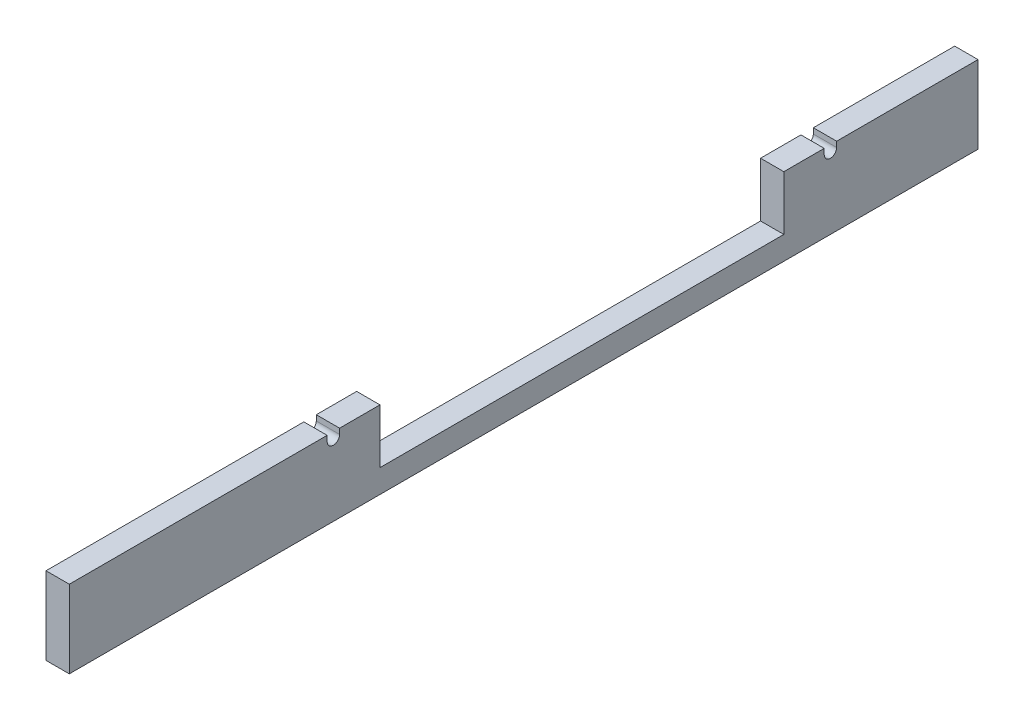
from build123d import *

# Parameters (mm, degrees)
SALIENTE_EXTRUIR3_DEPTH = 15


with BuildPart() as part:
    # Croquis2 → Saliente-Extruir3 (new body)
    with BuildSketch(Plane(origin=(0, 0, 0), x_dir=(0, 0, -1), z_dir=(1, 0, 0))):
        with BuildLine():
            Line((0, 0), (585, 0))
            Line((585, 0), (585, 50))
            Line((585, 50), (494, 50))
            Line((494, 50), (494, 46.5))
            ThreePointArc((494, 46.5), (490, 42.5), (486, 46.5))
            Line((486, 46.5), (486, 50))
            Line((486, 50), (460, 50))
            Line((460, 50), (460, 15))
            Line((460, 15), (200, 15))
            Line((200, 15), (200, 50))
            Line((200, 50), (174, 50))
            Line((174, 50), (174, 46.5))
            ThreePointArc((174, 46.5), (170, 42.5), (166, 46.5))
            Line((166, 46.5), (166, 50))
            Line((166, 50), (0, 50))
            Line((0, 50), (0, 0))
        make_face()
    extrude(amount=SALIENTE_EXTRUIR3_DEPTH)


solid = part.part
